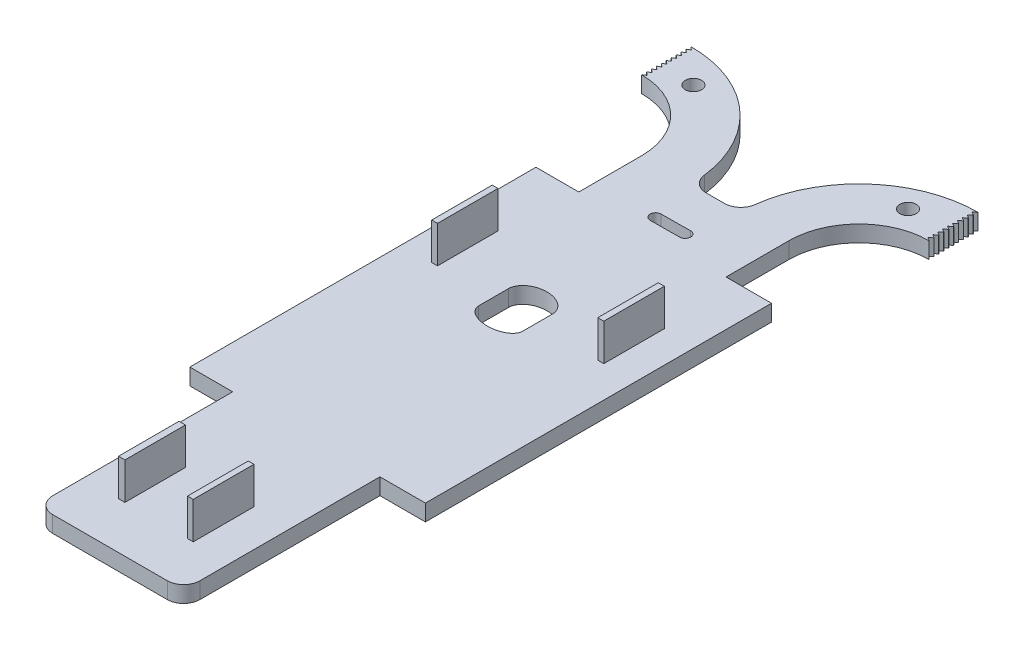
from build123d import *

# Parameters (mm, degrees)
BOSS_EXTRUDE1_DEPTH     = 10
SKETCH9_W               = 3.92
SKETCH9_H               = 37
SKETCH9_W_2             = 3.5
SKETCH9_H_2             = 37.126500488
SKETCH9_W_3             = 3.541288456
SKETCH9_W_4             = 3.69
BOSS_EXTRUDE5_DEPTH     = 22.5
CUT_EXTRUDE1_DEPTH      = 277.112166613
CUT_EXTRUDE1_DEPTH_BACK = 277.112166613
SKETCH9_3_R             = 5
FILLET1_R               = 10
FILLET2_R               = 10
FILLET3_R               = 10
FILLET4_R               = 10
BOSS_EXTRUDE6_DEPTH     = 10
SKETCH11_W              = 144
SKETCH11_H              = 11.545986826
BOSS_EXTRUDE7_DEPTH     = 10
CUT_EXTRUDE2_DEPTH      = 10


with BuildPart() as part:
    # Sketch1 → Boss-Extrude1 (new body)
    with BuildSketch(Plane(origin=(0, 0, 0), x_dir=(1, 0, 0), z_dir=(0, 1, 0))):
        with BuildLine():
            Line((-74.960217971, 156.809599724), (-74.960217971, 156.626779496))
            ThreePointArc((-74.960217971, 156.626779496), (-44.712594055, 144.09780344), (-32.183617999, 113.850179524))
            Line((-32.183617999, 113.850179524), (-32.183617999, -256.149820476))
            Line((-32.183617999, -256.149820476), (57.816382001, -256.149820476))
            Line((57.816382001, -256.149820476), (57.816382001, 113.850179524))
            ThreePointArc((57.816382001, 113.850179524), (70.345358056, 144.09780344), (100.592981972, 156.626779496))
            Line((100.592981972, 156.626779496), (100.592981972, 156.809599724))
            Line((100.592981972, 156.809599724), (98.613342132, 157.989769628))
            Line((98.613342132, 157.989769628), (100.592981972, 159.626779496))
            Line((100.592981972, 159.626779496), (100.592981972, 159.809599724))
            Line((100.592981972, 159.809599724), (98.613342132, 160.989769628))
            Line((98.613342132, 160.989769628), (100.592981972, 162.626779496))
            Line((100.592981972, 162.626779496), (100.592981972, 162.809599724))
            Line((100.592981972, 162.809599724), (98.613342132, 163.989769628))
            Line((98.613342132, 163.989769628), (100.592981972, 165.626779496))
            Line((100.592981972, 165.626779496), (100.592981972, 165.809599724))
            Line((100.592981972, 165.809599724), (98.613342132, 166.989769628))
            Line((98.613342132, 166.989769628), (100.592981972, 168.626779496))
            Line((100.592981972, 168.626779496), (100.592981972, 168.809599724))
            Line((100.592981972, 168.809599724), (98.613342132, 169.989769628))
            Line((98.613342132, 169.989769628), (100.592981972, 171.626779496))
            Line((100.592981972, 171.626779496), (100.592981972, 171.809599724))
            Line((100.592981972, 171.809599724), (98.613342132, 172.989769628))
            Line((98.613342132, 172.989769628), (100.592981972, 174.626779496))
            Line((100.592981972, 174.626779496), (100.592981972, 174.809599724))
            Line((100.592981972, 174.809599724), (98.613342132, 175.989769628))
            Line((98.613342132, 175.989769628), (100.592981972, 177.626779496))
            Line((100.592981972, 177.626779496), (100.592981972, 177.809599724))
            Line((100.592981972, 177.809599724), (98.613342132, 178.989769628))
            Line((98.613342132, 178.989769628), (100.592981972, 180.626779496))
            Line((100.592981972, 180.626779496), (100.592981972, 180.809599724))
            Line((100.592981972, 180.809599724), (98.613342132, 181.989769628))
            Line((98.613342132, 181.989769628), (100.592981972, 183.626779496))
            Line((100.592981972, 183.626779496), (100.592981972, 183.809599724))
            Line((100.592981972, 183.809599724), (98.613342132, 184.989769628))
            Line((98.613342132, 184.989769628), (100.592981972, 186.626779496))
            ThreePointArc((100.592981972, 186.626779496), (49.132154621, 165.311006876), (27.816382001, 113.850179524))
            Line((27.816382001, 113.850179524), (12.816382001, 113.850179524))
            Line((12.816382001, 113.850179524), (-2.183617999, 113.850179524))
            ThreePointArc((-2.183617999, 113.850179524), (-23.499390619, 165.311006876), (-74.960217971, 186.626779496))
            Line((-74.960217971, 186.626779496), (-72.980578131, 184.989769628))
            Line((-72.980578131, 184.989769628), (-74.960217971, 183.809599724))
            Line((-74.960217971, 183.809599724), (-74.960217971, 183.626779496))
            Line((-74.960217971, 183.626779496), (-72.980578131, 181.989769628))
            Line((-72.980578131, 181.989769628), (-74.960217971, 180.809599724))
            Line((-74.960217971, 180.809599724), (-74.960217971, 180.626779496))
            Line((-74.960217971, 180.626779496), (-72.980578131, 178.989769628))
            Line((-72.980578131, 178.989769628), (-74.960217971, 177.809599724))
            Line((-74.960217971, 177.809599724), (-74.960217971, 177.626779496))
            Line((-74.960217971, 177.626779496), (-72.980578131, 175.989769628))
            Line((-72.980578131, 175.989769628), (-74.960217971, 174.809599724))
            Line((-74.960217971, 174.809599724), (-74.960217971, 174.626779496))
            Line((-74.960217971, 174.626779496), (-72.980578131, 172.989769628))
            Line((-72.980578131, 172.989769628), (-74.960217971, 171.809599724))
            Line((-74.960217971, 171.809599724), (-74.960217971, 171.626779496))
            Line((-74.960217971, 171.626779496), (-72.980578131, 169.989769628))
            Line((-72.980578131, 169.989769628), (-74.960217971, 168.809599724))
            Line((-74.960217971, 168.809599724), (-74.960217971, 168.626779496))
            Line((-74.960217971, 168.626779496), (-72.980578131, 166.989769628))
            Line((-72.980578131, 166.989769628), (-74.960217971, 165.809599724))
            Line((-74.960217971, 165.809599724), (-74.960217971, 165.626779496))
            Line((-74.960217971, 165.626779496), (-72.980578131, 163.989769628))
            Line((-72.980578131, 163.989769628), (-74.960217971, 162.809599724))
            Line((-74.960217971, 162.809599724), (-74.960217971, 162.626779496))
            Line((-74.960217971, 162.626779496), (-72.980578131, 160.989769628))
            Line((-72.980578131, 160.989769628), (-74.960217971, 159.809599724))
            Line((-74.960217971, 159.809599724), (-74.960217971, 159.626779496))
            Line((-74.960217971, 159.626779496), (-72.980578131, 157.989769628))
            Line((-72.980578131, 157.989769628), (-74.960217971, 156.809599724))
        make_face()
    extrude(amount=BOSS_EXTRUDE1_DEPTH)

    # Sketch9 → Boss-Extrude5 (add)
    with BuildSketch(Plane(origin=(0, 10, 0), x_dir=(1, 0, 0), z_dir=(0, 1, 0))):
        with Locations((-8.526417695, -209.150271155)):
            Rectangle(SKETCH9_W, SKETCH9_H)
        with Locations((33.437512474, -209.087020911)):
            Rectangle(SKETCH9_W_2, SKETCH9_H_2)
        with Locations((-38.024500938, 11.585050009)):
            Rectangle(SKETCH9_W_3, SKETCH9_H)
        with Locations((64.489482657, 10.658923544)):
            Rectangle(SKETCH9_W_4, SKETCH9_H)
    extrude(amount=BOSS_EXTRUDE5_DEPTH)


with BuildPart() as boss_extrude5_piece_1:
    # of the separate pieces the step leaves, piece 1, a body of its own (boss_extrude5_pieces)
    add(part.part.solids().sort_by_distance((-2.183617999, 0, -113.850179524))[0])

    # Sketch9<3> → Cut-Extrude1 (cut, two sides: drawn at the far end of the back side and taken through both)
    with BuildSketch(Plane(origin=(0, 10, 0), x_dir=(1, 0, 0), z_dir=(0, 1, 0)).offset(-CUT_EXTRUDE1_DEPTH_BACK)):
        with BuildLine():
            Line((4.664282568, 82.183183807), (22.569718474, 82.34305377))
            ThreePointArc((22.569718474, 82.34305377), (25.882601331, 85.71562821), (22.510026891, 89.028511067))
            Line((22.510026891, 89.028511067), (4.604590985, 88.868641103))
            ThreePointArc((4.604590985, 88.868641103), (1.291708128, 85.496066664), (4.664282568, 82.183183807))
        make_face()
        with Locations((-53.766761214, 167.027229772)):
            Circle(SKETCH9_3_R)
        with Locations((77.419859554, 167.027229772)):
            Circle(SKETCH9_3_R)
    extrude(amount=CUT_EXTRUDE1_DEPTH + CUT_EXTRUDE1_DEPTH_BACK, mode=Mode.SUBTRACT)

    # Fillet1
    fillet1_edges = [boss_extrude5_piece_1.edges().sort_by_distance(p)[0] for p in [
        (-32.183617999, 5, 256.149820476),
    ]]
    fillet(fillet1_edges, radius=FILLET1_R)

    # Fillet2
    fillet2_edges = [boss_extrude5_piece_1.edges().sort_by_distance(p)[0] for p in [
        (57.816382001, 5, 256.149820476),
    ]]
    fillet(fillet2_edges, radius=FILLET2_R)

    # Fillet3
    fillet3_edges = [boss_extrude5_piece_1.edges().sort_by_distance(p)[0] for p in [
        (27.816382001, 5, -113.850179524),
    ]]
    fillet(fillet3_edges, radius=FILLET3_R)

    # Fillet4
    fillet4_edges = [boss_extrude5_piece_1.edges().sort_by_distance(p)[0] for p in [
        (-2.183617999, 5, -113.850179524),
    ]]
    fillet(fillet4_edges, radius=FILLET4_R)

    # Sketch10 → Boss-Extrude6 (add)
    with BuildSketch(Plane(origin=(0, 10, 0), x_dir=(1, 0, 0), z_dir=(0, 1, 0))):
        Polygon((-58.382999479, 75.396165624), (85.617000521, 75.396165624), (85.617000521, -124.603834376), (13.617000521, -124.603834376), (-58.382999479, -124.603834376), align=None)
    extrude(amount=-BOSS_EXTRUDE6_DEPTH)

    # Sketch11 → Boss-Extrude7 (add)
    with BuildSketch(Plane(origin=(0, 10, 0), x_dir=(1, 0, 0), z_dir=(0, 1, 0))):
        with Locations((13.617000521, -130.376827789)):
            Rectangle(SKETCH11_W, SKETCH11_H)
    extrude(amount=-BOSS_EXTRUDE7_DEPTH)

    # Sketch12 → Cut-Extrude2 (cut, symmetric)
    with BuildSketch(Plane(origin=(0, 10, 0), x_dir=(1, 0, 0), z_dir=(0, 1, 0))):
        with BuildLine():
            Line((-2.527057268, -15.463769637), (-2.527057268, 2.698732135))
            add(Edge.make_bspline(
                [(24.364249195, 2.698732135), (24.364249195, 12.775076767), (10.918595964, 12.775076767), (-2.527057268, 12.775076767), (-2.527057268, 2.698732135)],
                knots=[0, 0, 0, 1.570796327, 1.570796327, 3.141592654, 3.141592654, 3.141592654], degree=2, weights=[1, 0.707106781, 1, 0.707106781, 1]))
            Line((24.364249195, 2.698732135), (24.364249195, -15.463769637))
            add(Edge.make_bspline(
                [(-2.527057268, -15.463769637), (-2.527057268, -23.540766762), (10.918595964, -23.540766762), (24.364249195, -23.540766762), (24.364249195, -15.463769637)],
                knots=[0, 0, 0, 1.570796327, 1.570796327, 3.141592654, 3.141592654, 3.141592654], degree=2, weights=[1, 0.707106781, 1, 0.707106781, 1]))
        make_face()
    extrude(amount=CUT_EXTRUDE2_DEPTH, both=True, mode=Mode.SUBTRACT)


with BuildPart() as boss_extrude5_piece_2:
    # of the separate pieces the step leaves, piece 2, a body of its own (boss_extrude5_pieces)
    add(part.part.solids().sort_by_distance((62.644482657, 10, -29.158923544))[0])


with BuildPart() as boss_extrude5_piece_3:
    # of the separate pieces the step leaves, piece 3, a body of its own (boss_extrude5_pieces)
    add(part.part.solids().sort_by_distance((-39.795145166, 10, -30.085050009))[0])


solid = Compound([boss_extrude5_piece_1.part, boss_extrude5_piece_2.part, boss_extrude5_piece_3.part])
